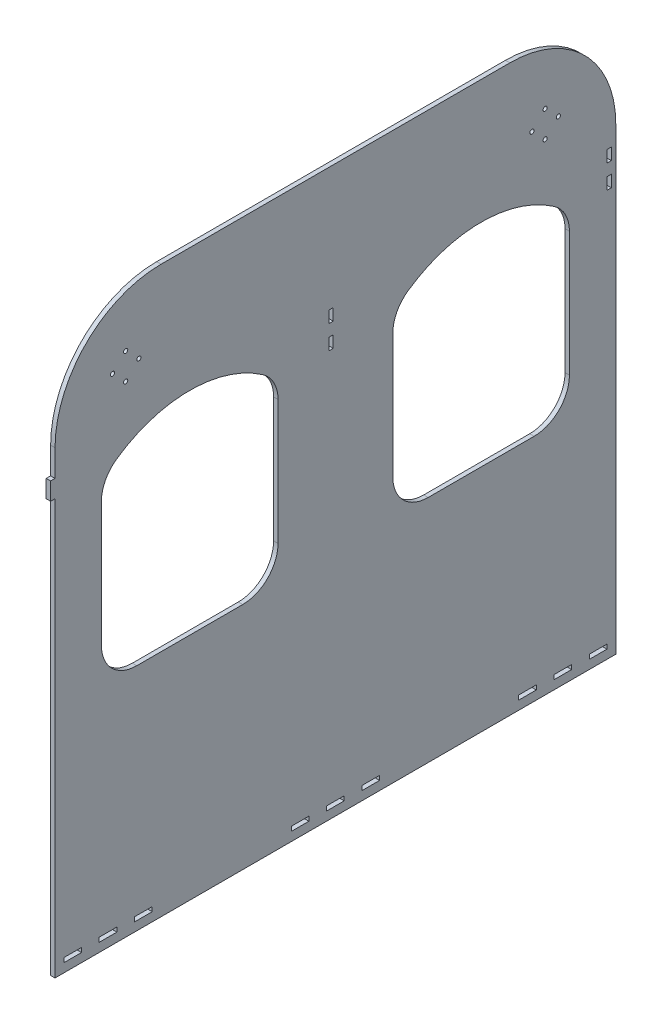
from build123d import *

# Parameters (mm, degrees)
BOSS_EXTRUDE1_DEPTH = 3.175
SKETCH2_W           = 3.175
SKETCH2_H           = 8.466666667
CUT_EXTRUDE1_DEPTH  = 3.175
SKETCH3_W           = 3.175
SKETCH3_H           = 12.7
BOSS_EXTRUDE2_DEPTH = 3.175
CUT_EXTRUDE2_DEPTH  = 3.175
SKETCH5_W           = 12.7
SKETCH5_H           = 3.175
CUT_EXTRUDE3_DEPTH  = 3.175
SKETCH6_W           = 12.7
SKETCH6_H           = 3.175
CUT_EXTRUDE4_DEPTH  = 3.175
CUT_EXTRUDE5_DEPTH  = 3.175


with BuildPart() as part:
    # Sketch1 → Boss-Extrude1 (new body)
    with BuildSketch(Plane(origin=(0, 0, 0), x_dir=(0, 0, -1), z_dir=(1, 0, 0))):
        with BuildLine():
            Line((-201.6125, -203.2), (201.6125, -203.2))
            Line((201.6125, -203.2), (201.6125, 127))
            ThreePointArc((201.6125, 127), (179.294036726, 180.881536726), (125.4125, 203.2))
            Line((125.4125, 203.2), (-125.4125, 203.2))
            ThreePointArc((-125.4125, 203.2), (-179.294036726, 180.881536726), (-201.6125, 127))
            Line((-201.6125, 127), (-201.6125, -203.2))
        make_face()
    extrude(amount=BOSS_EXTRUDE1_DEPTH)

    # Sketch2 → Cut-Extrude1 (cut)
    with BuildSketch(Plane(origin=(3.175, 0, 0), x_dir=(0, 0, -1), z_dir=(1, 0, 0))):
        with Locations((-3.175, 110.066666667)):
            Rectangle(SKETCH2_W, SKETCH2_H)
        with Locations((196.85, 110.066666667)):
            Rectangle(SKETCH2_W, SKETCH2_H)
        with Locations((196.85, 93.133333334)):
            Rectangle(SKETCH2_W, SKETCH2_H)
        with Locations((-3.175, 93.133333334)):
            Rectangle(SKETCH2_W, SKETCH2_H)
    extrude(amount=-CUT_EXTRUDE1_DEPTH, mode=Mode.SUBTRACT)

    # Sketch3 → Boss-Extrude2 (add)
    with BuildSketch(Plane.XY.offset(201.6125)):
        with Locations((1.5875, 101.6)):
            Rectangle(SKETCH3_W, SKETCH3_H)
    extrude(amount=BOSS_EXTRUDE2_DEPTH)

    # Sketch4 → Cut-Extrude2 (cut)
    with BuildSketch(Plane(origin=(3.175, 0, 0), x_dir=(0, 0, -1), z_dir=(1, 0, 0))):
        with BuildLine():
            Line((-168.275, 76.941959208), (-168.275, -12.7))
            ThreePointArc((-168.275, -12.7), (-160.835512242, -30.660512242), (-142.875, -38.1))
            Line((-142.875, -38.1), (-66.675, -38.1))
            ThreePointArc((-66.675, -38.1), (-48.714487758, -30.660512242), (-41.275, -12.7))
            Line((-41.275, -12.7), (-41.275, 76.941959208))
            ThreePointArc((-41.275, 76.941959208), (-44.160306385, 88.699874475), (-52.160714286, 97.786515097))
            ThreePointArc((-52.160714286, 97.786515097), (-104.775, 114.3), (-157.389285714, 97.786515097))
            ThreePointArc((-157.389285714, 97.786515097), (-165.389693615, 88.699874475), (-168.275, 76.941959208))
        make_face()
        with BuildLine():
            Line((168.275, 76.941959208), (168.275, -12.7))
            ThreePointArc((168.275, -12.7), (160.835512242, -30.660512242), (142.875, -38.1))
            Line((142.875, -38.1), (66.675, -38.1))
            ThreePointArc((66.675, -38.1), (48.714487758, -30.660512242), (41.275, -12.7))
            Line((41.275, -12.7), (41.275, 76.941959208))
            ThreePointArc((41.275, 76.941959208), (44.160306385, 88.699874475), (52.160714286, 97.786515097))
            ThreePointArc((52.160714286, 97.786515097), (104.775, 114.3), (157.389285714, 97.786515097))
            ThreePointArc((157.389285714, 97.786515097), (165.389693615, 88.699874475), (168.275, 76.941959208))
        make_face()
    extrude(amount=-CUT_EXTRUDE2_DEPTH, mode=Mode.SUBTRACT)

    # Sketch5 → Cut-Extrude3 (cut)
    with BuildSketch(Plane(origin=(3.175, 0, 0), x_dir=(0, 0, -1), z_dir=(1, 0, 0))):
        with Locations((-188.9125, -195.2625)):
            Rectangle(SKETCH5_W, SKETCH5_H)
        with Locations((-163.5125, -195.2625)):
            Rectangle(SKETCH5_W, SKETCH5_H)
        with Locations((-138.1125, -195.2625)):
            Rectangle(SKETCH5_W, SKETCH5_H)
    cut_extrude3 = extrude(amount=-CUT_EXTRUDE3_DEPTH, mode=Mode.SUBTRACT)

    # Mirror1: Cut-Extrude3 across plane
    add(cut_extrude3.mirror(Plane.XY), mode=Mode.SUBTRACT)

    # Sketch6 → Cut-Extrude4 (cut)
    with BuildSketch(Plane(origin=(3.175, 0, 0), x_dir=(0, 0, -1), z_dir=(1, 0, 0))):
        with Locations((-25.4, -195.2625)):
            Rectangle(SKETCH6_W, SKETCH6_H)
        with Locations((0, -195.2625)):
            Rectangle(SKETCH6_W, SKETCH6_H)
        with Locations((25.4, -195.2625)):
            Rectangle(SKETCH6_W, SKETCH6_H)
    extrude(amount=-CUT_EXTRUDE4_DEPTH, mode=Mode.SUBTRACT)

    # Sketch7 → Cut-Extrude5 (cut)
    with BuildSketch(Plane(origin=(3.175, 0, 0), x_dir=(0, 0, -1), z_dir=(1, 0, 0))):
        with BuildLine():
            ThreePointArc((-158.8125, 152.4), (-158.926680701, 152.974025149), (-159.251839828, 153.460660172))
            Line((-159.251839828, 153.460660172), (-160.3125, 152.4))
            Line((-160.3125, 152.4), (-159.251839828, 151.339339828))
            ThreePointArc((-159.251839828, 151.339339828), (-158.926680701, 151.825974851), (-158.8125, 152.4))
        make_face()
        with BuildLine():
            Line((-160.3125, 152.4), (-159.251839828, 153.460660172))
            ThreePointArc((-159.251839828, 153.460660172), (-161.8125, 152.4), (-159.251839828, 151.339339828))
            Line((-159.251839828, 151.339339828), (-160.3125, 152.4))
        make_face()
        with BuildLine():
            Line((-149.751839828, 160.839339828), (-150.8125, 161.9))
            Line((-150.8125, 161.9), (-151.873160172, 160.839339828))
            ThreePointArc((-151.873160172, 160.839339828), (-150.8125, 160.4), (-149.751839828, 160.839339828))
        make_face()
        with BuildLine():
            Line((-151.873160172, 160.839339828), (-150.8125, 161.9))
            Line((-150.8125, 161.9), (-149.751839828, 160.839339828))
            ThreePointArc((-149.751839828, 160.839339828), (-149.426680701, 161.325974851), (-149.3125, 161.9))
            ThreePointArc((-149.3125, 161.9), (-151.386525149, 163.285819299), (-151.873160172, 160.839339828))
        make_face()
        with BuildLine():
            ThreePointArc((-139.8125, 152.4), (-140.738474851, 153.785819299), (-142.373160172, 153.460660172))
            Line((-142.373160172, 153.460660172), (-141.3125, 152.4))
            Line((-141.3125, 152.4), (-142.373160172, 151.339339828))
            ThreePointArc((-142.373160172, 151.339339828), (-140.738474851, 151.014180701), (-139.8125, 152.4))
        make_face()
        with BuildLine():
            Line((-141.3125, 152.4), (-142.373160172, 153.460660172))
            ThreePointArc((-142.373160172, 153.460660172), (-142.8125, 152.4), (-142.373160172, 151.339339828))
            Line((-142.373160172, 151.339339828), (-141.3125, 152.4))
        make_face()
        with BuildLine():
            ThreePointArc((-149.751839828, 143.960660172), (-150.8125, 144.4), (-151.873160172, 143.960660172))
            Line((-151.873160172, 143.960660172), (-150.8125, 142.9))
            Line((-150.8125, 142.9), (-149.751839828, 143.960660172))
        make_face()
        with BuildLine():
            Line((-150.8125, 142.9), (-151.873160172, 143.960660172))
            ThreePointArc((-151.873160172, 143.960660172), (-151.386525149, 141.514180701), (-149.3125, 142.9))
            ThreePointArc((-149.3125, 142.9), (-149.426680701, 143.474025149), (-149.751839828, 143.960660172))
            Line((-149.751839828, 143.960660172), (-150.8125, 142.9))
        make_face()
    cut_extrude5 = extrude(amount=-CUT_EXTRUDE5_DEPTH, mode=Mode.SUBTRACT)

    # Mirror2: Cut-Extrude5 across plane
    add(cut_extrude5.mirror(Plane.XY), mode=Mode.SUBTRACT)


solid = part.part
